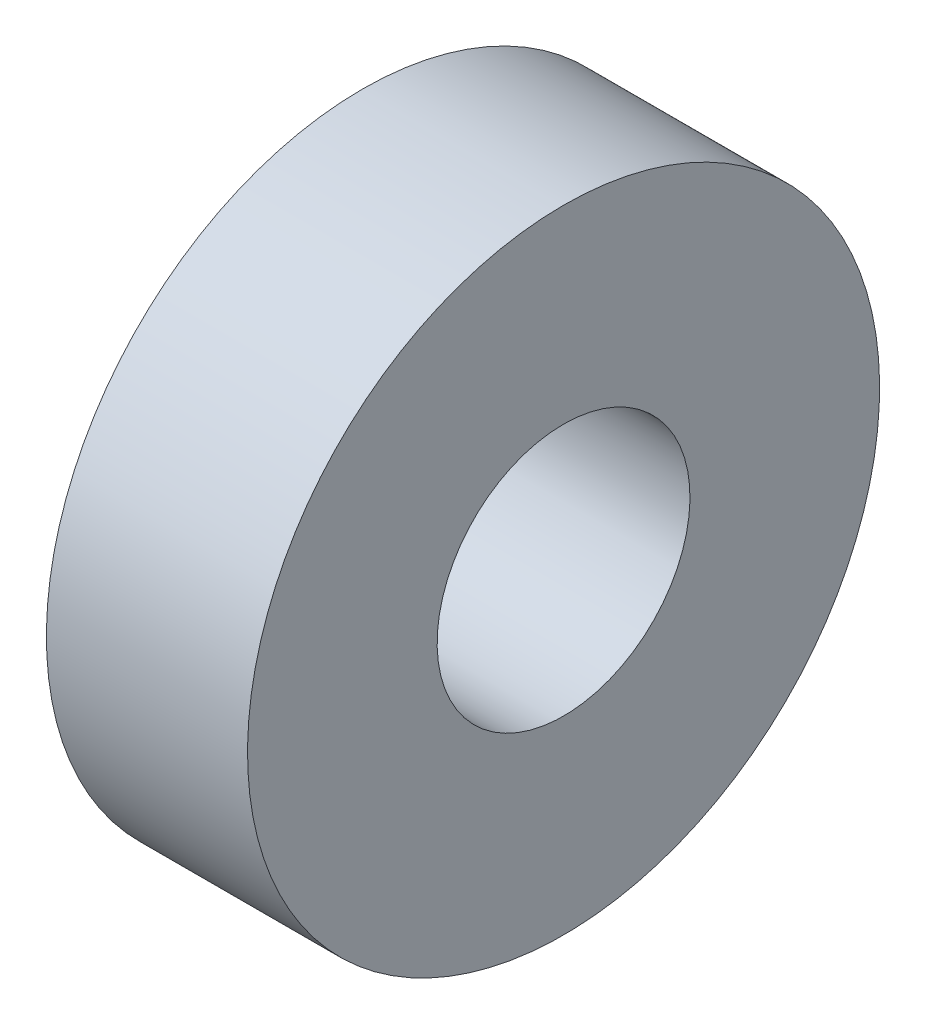
from build123d import *

# Parameters (mm, degrees)
SKETCH1_W      = 350
SKETCH1_H      = 330
REVOLVE1_ANGLE = 359.999999589


with BuildPart() as part:
    # Sketch1 → Revolve1 (revolve)
    with BuildSketch(Plane.XY):
        with Locations((1075, 385)):
            Rectangle(SKETCH1_W, SKETCH1_H)
    revolve(axis=Axis((0, 0, 0), (1, 0, 0)), revolution_arc=REVOLVE1_ANGLE)


solid = part.part
